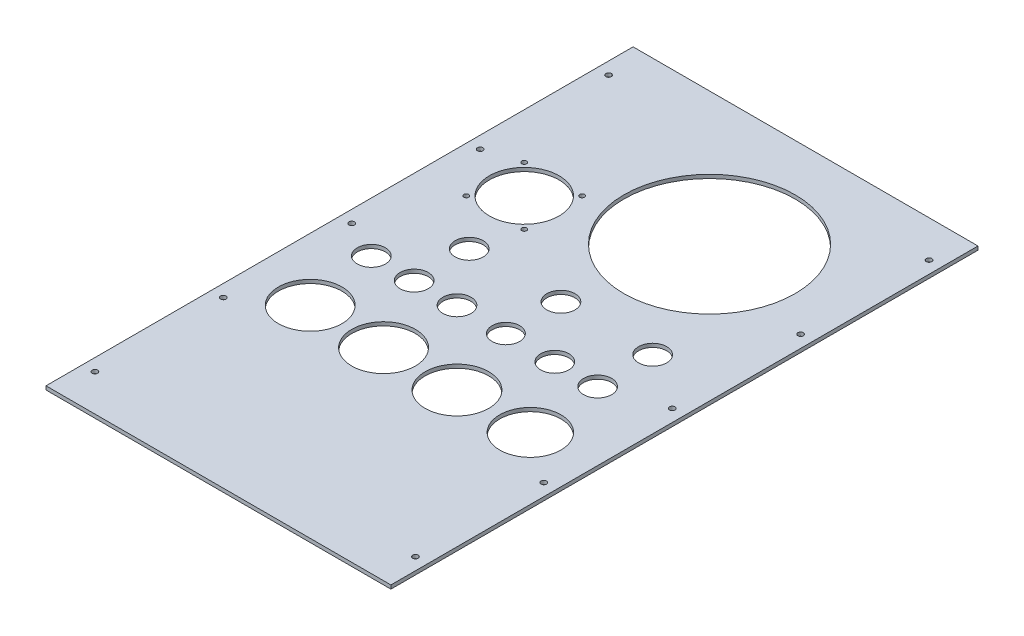
from build123d import *

# Parameters (mm, degrees)
SKETCH1_W                  = 282
SKETCH1_H                  = 480
BOSS_EXTRUDE1_DEPTH        = 3
CUT_EXTRUDE1_REACH         = 558.716
SKETCH2_R                  = 70
SKETCH2_R_2                = 28.5
SKETCH2_R_3                = 25
SKETCH2_R_4                = 26
SKETCH2_R_5                = 11.5
SKETCH2_R_6                = 11.25
F_4_5_4_5_DIAMETER_HOLE1_D = 4.5
F_4_0_4_DIAMETER_HOLE1_D   = 4


with BuildPart() as part:
    # Sketch1 → Boss-Extrude1 (new body)
    with BuildSketch(Plane(origin=(0, 0, 0), x_dir=(1, 0, 0), z_dir=(0, 1, 0))):
        with Locations((141, 240)):
            Rectangle(SKETCH1_W, SKETCH1_H)
    extrude(amount=BOSS_EXTRUDE1_DEPTH)

    # Sketch2 → Cut-Extrude1 (cut, up to next)
    with BuildSketch(Plane(origin=(0, 3, 0), x_dir=(1, 0, 0), z_dir=(0, 1, 0)), mode=Mode.PRIVATE) as cut_extrude1_sk1:
        with Locations(Location((171, 371.5, 0), (0, 0, 270))):
            Circle(SKETCH2_R)
    cut_extrude1_tool1 = extrude(cut_extrude1_sk1.sketch, amount=-CUT_EXTRUDE1_REACH, mode=Mode.PRIVATE) & part.part
    # Sketch2 → Cut-Extrude1 (cut, up to next)
    with BuildSketch(Plane(origin=(0, 3, 0), x_dir=(1, 0, 0), z_dir=(0, 1, 0)), mode=Mode.PRIVATE) as cut_extrude1_sk2:
        with Locations(Location((61, 330, 0), (0, 0, 270))):
            Circle(SKETCH2_R_2)
    cut_extrude1_tool2 = extrude(cut_extrude1_sk2.sketch, amount=-CUT_EXTRUDE1_REACH, mode=Mode.PRIVATE) & part.part
    # Sketch2 → Cut-Extrude1 (cut, up to next)
    with BuildSketch(Plane(origin=(0, 3, 0), x_dir=(1, 0, 0), z_dir=(0, 1, 0)), mode=Mode.PRIVATE) as cut_extrude1_sk3:
        with Locations(Location((231, 165, 0), (0, 0, 270))):
            Circle(SKETCH2_R_3)
    cut_extrude1_tool3 = extrude(cut_extrude1_sk3.sketch, amount=-CUT_EXTRUDE1_REACH, mode=Mode.PRIVATE) & part.part
    # Sketch2 → Cut-Extrude1 (cut, up to next)
    with BuildSketch(Plane(origin=(0, 3, 0), x_dir=(1, 0, 0), z_dir=(0, 1, 0)), mode=Mode.PRIVATE) as cut_extrude1_sk4:
        with Locations(Location((171, 165, 0), (0, 0, 270))):
            Circle(SKETCH2_R_4)
    cut_extrude1_tool4 = extrude(cut_extrude1_sk4.sketch, amount=-CUT_EXTRUDE1_REACH, mode=Mode.PRIVATE) & part.part
    # Sketch2 → Cut-Extrude1 (cut, up to next)
    with BuildSketch(Plane(origin=(0, 3, 0), x_dir=(1, 0, 0), z_dir=(0, 1, 0)), mode=Mode.PRIVATE) as cut_extrude1_sk5:
        with Locations(Location((111, 165, 0), (0, 0, 270))):
            Circle(SKETCH2_R_4)
    cut_extrude1_tool5 = extrude(cut_extrude1_sk5.sketch, amount=-CUT_EXTRUDE1_REACH, mode=Mode.PRIVATE) & part.part
    # Sketch2 → Cut-Extrude1 (cut, up to next)
    with BuildSketch(Plane(origin=(0, 3, 0), x_dir=(1, 0, 0), z_dir=(0, 1, 0)), mode=Mode.PRIVATE) as cut_extrude1_sk6:
        with Locations(Location((51, 165, 0), (0, 0, 270))):
            Circle(SKETCH2_R_4)
    cut_extrude1_tool6 = extrude(cut_extrude1_sk6.sketch, amount=-CUT_EXTRUDE1_REACH, mode=Mode.PRIVATE) & part.part
    # Sketch2 → Cut-Extrude1 (cut, up to next)
    with BuildSketch(Plane(origin=(0, 3, 0), x_dir=(1, 0, 0), z_dir=(0, 1, 0)), mode=Mode.PRIVATE) as cut_extrude1_sk7:
        with Locations(Location((41, 225, 0), (0, 0, 270))):
            Circle(SKETCH2_R_5)
    cut_extrude1_tool7 = extrude(cut_extrude1_sk7.sketch, amount=-CUT_EXTRUDE1_REACH, mode=Mode.PRIVATE) & part.part
    # Sketch2 → Cut-Extrude1 (cut, up to next)
    with BuildSketch(Plane(origin=(0, 3, 0), x_dir=(1, 0, 0), z_dir=(0, 1, 0)), mode=Mode.PRIVATE) as cut_extrude1_sk8:
        with Locations(Location((76, 225, 0), (0, 0, 270))):
            Circle(SKETCH2_R_5)
    cut_extrude1_tool8 = extrude(cut_extrude1_sk8.sketch, amount=-CUT_EXTRUDE1_REACH, mode=Mode.PRIVATE) & part.part
    # Sketch2 → Cut-Extrude1 (cut, up to next)
    with BuildSketch(Plane(origin=(0, 3, 0), x_dir=(1, 0, 0), z_dir=(0, 1, 0)), mode=Mode.PRIVATE) as cut_extrude1_sk9:
        with Locations(Location((111, 225, 0), (0, 0, 270))):
            Circle(SKETCH2_R_5)
    cut_extrude1_tool9 = extrude(cut_extrude1_sk9.sketch, amount=-CUT_EXTRUDE1_REACH, mode=Mode.PRIVATE) & part.part
    # Sketch2 → Cut-Extrude1 (cut, up to next)
    with BuildSketch(Plane(origin=(0, 3, 0), x_dir=(1, 0, 0), z_dir=(0, 1, 0)), mode=Mode.PRIVATE) as cut_extrude1_sk10:
        with Locations(Location((76, 270, 0), (0, 0, 270))):
            Circle(SKETCH2_R_5)
    cut_extrude1_tool10 = extrude(cut_extrude1_sk10.sketch, amount=-CUT_EXTRUDE1_REACH, mode=Mode.PRIVATE) & part.part
    # Sketch2 → Cut-Extrude1 (cut, up to next)
    with BuildSketch(Plane(origin=(0, 3, 0), x_dir=(1, 0, 0), z_dir=(0, 1, 0)), mode=Mode.PRIVATE) as cut_extrude1_sk11:
        with Locations(Location((151, 270, 0), (0, 0, 270))):
            Circle(SKETCH2_R_5)
    cut_extrude1_tool11 = extrude(cut_extrude1_sk11.sketch, amount=-CUT_EXTRUDE1_REACH, mode=Mode.PRIVATE) & part.part
    # Sketch2 → Cut-Extrude1 (cut, up to next)
    with BuildSketch(Plane(origin=(0, 3, 0), x_dir=(1, 0, 0), z_dir=(0, 1, 0)), mode=Mode.PRIVATE) as cut_extrude1_sk12:
        with Locations(Location((191, 225, 0), (0, 0, 270))):
            Circle(SKETCH2_R_5)
    cut_extrude1_tool12 = extrude(cut_extrude1_sk12.sketch, amount=-CUT_EXTRUDE1_REACH, mode=Mode.PRIVATE) & part.part
    # Sketch2 → Cut-Extrude1 (cut, up to next)
    with BuildSketch(Plane(origin=(0, 3, 0), x_dir=(1, 0, 0), z_dir=(0, 1, 0)), mode=Mode.PRIVATE) as cut_extrude1_sk13:
        with Locations(Location((226, 270, 0), (0, 0, 270))):
            Circle(SKETCH2_R_5)
    cut_extrude1_tool13 = extrude(cut_extrude1_sk13.sketch, amount=-CUT_EXTRUDE1_REACH, mode=Mode.PRIVATE) & part.part
    # Sketch2 → Cut-Extrude1 (cut, up to next)
    with BuildSketch(Plane(origin=(0, 3, 0), x_dir=(1, 0, 0), z_dir=(0, 1, 0)), mode=Mode.PRIVATE) as cut_extrude1_sk14:
        with Locations(Location((226, 225, 0), (0, 0, 270))):
            Circle(SKETCH2_R_5)
    cut_extrude1_tool14 = extrude(cut_extrude1_sk14.sketch, amount=-CUT_EXTRUDE1_REACH, mode=Mode.PRIVATE) & part.part
    # Sketch2 → Cut-Extrude1 (cut, up to next)
    with BuildSketch(Plane(origin=(0, 3, 0), x_dir=(1, 0, 0), z_dir=(0, 1, 0)), mode=Mode.PRIVATE) as cut_extrude1_sk15:
        with Locations(Location((151, 225, 0), (0, 0, 270))):
            Circle(SKETCH2_R_6)
    cut_extrude1_tool15 = extrude(cut_extrude1_sk15.sketch, amount=-CUT_EXTRUDE1_REACH, mode=Mode.PRIVATE) & part.part
    add(cut_extrude1_tool1.solids().sort_by_distance((171, 3, -371.5))[0], mode=Mode.SUBTRACT)
    add(cut_extrude1_tool2.solids().sort_by_distance((61, 3, -330))[0], mode=Mode.SUBTRACT)
    add(cut_extrude1_tool3.solids().sort_by_distance((231, 3, -165))[0], mode=Mode.SUBTRACT)
    add(cut_extrude1_tool4.solids().sort_by_distance((171, 3, -165))[0], mode=Mode.SUBTRACT)
    add(cut_extrude1_tool5.solids().sort_by_distance((111, 3, -165))[0], mode=Mode.SUBTRACT)
    add(cut_extrude1_tool6.solids().sort_by_distance((51, 3, -165))[0], mode=Mode.SUBTRACT)
    add(cut_extrude1_tool7.solids().sort_by_distance((41, 3, -225))[0], mode=Mode.SUBTRACT)
    add(cut_extrude1_tool8.solids().sort_by_distance((76, 3, -225))[0], mode=Mode.SUBTRACT)
    add(cut_extrude1_tool9.solids().sort_by_distance((111, 3, -225))[0], mode=Mode.SUBTRACT)
    add(cut_extrude1_tool10.solids().sort_by_distance((76, 3, -270))[0], mode=Mode.SUBTRACT)
    add(cut_extrude1_tool11.solids().sort_by_distance((151, 3, -270))[0], mode=Mode.SUBTRACT)
    add(cut_extrude1_tool12.solids().sort_by_distance((191, 3, -225))[0], mode=Mode.SUBTRACT)
    add(cut_extrude1_tool13.solids().sort_by_distance((226, 3, -270))[0], mode=Mode.SUBTRACT)
    add(cut_extrude1_tool14.solids().sort_by_distance((226, 3, -225))[0], mode=Mode.SUBTRACT)
    add(cut_extrude1_tool15.solids().sort_by_distance((151, 3, -225))[0], mode=Mode.SUBTRACT)

    # Ø4.5 (4.5) Diameter Hole1 (through all)
    with Locations(Plane(origin=(0, 0, 0), x_dir=(-1, 0, 0), z_dir=(0, -1, 0))):
        with Locations((-272, 450), (-272, 345), (-272, 240), (-272, 135), (-272, 30), (-10, 345), (-10, 240), (-10, 135), (-10, 30), (-10, 450)):
            Hole(F_4_5_4_5_DIAMETER_HOLE1_D / 2)

    # Ø4.0 (4) Diameter Hole1 (through all)
    with Locations(Plane(origin=(0, 0, 0), x_dir=(-1, 0, 0), z_dir=(0, -1, 0))):
        with Locations((-84.68807717, 353.68807717), (-37.31192283, 353.68807717), (-37.31192283, 306.31192283), (-84.68807717, 306.31192283)):
            Hole(F_4_0_4_DIAMETER_HOLE1_D / 2)


solid = part.part
